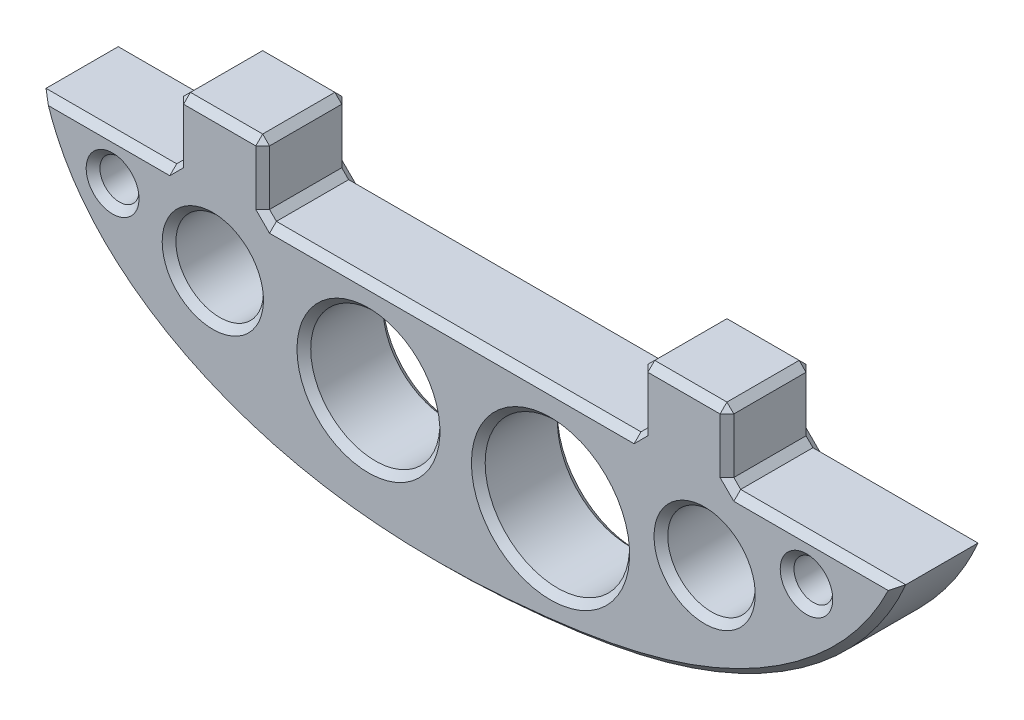
from build123d import *

# Parameters (mm, degrees)
AUFSATZ_LINEAR_AUSTRAGEN1_DEPTH = 5
SKIZZE2_W                       = 5
SKIZZE2_H                       = 5
AUFSATZ_LINEAR_AUSTRAGEN2_DEPTH = 4
SKIZZE3_R                       = 2.543920863
SKIZZE3_R_2                     = 3.757489783
SKIZZE3_R_3                     = 4.2
SKIZZE3_R_4                     = 1.137730448
SKIZZE3_R_5                     = 1.128844842
SCHNITT_LINEAR_AUSTRAGEN1_DEPTH = 29.376694263
FASE1_SIZE                      = 0.4


with BuildPart() as part:
    # Skizze1 → Aufsatz-Linear austragen1 (new body)
    with BuildSketch(Plane.XY):
        with BuildLine():
            Line((-24.996538994, 0), (25.003461006, 0))
            add(Edge.make_bspline(
                [(-24.996538994, 0), (-23.465552519, -5.427530288), (-13.555397464, -12.470085354), (1.646590995, -12.822293736), (15.822536598, -10.26391571), (23.061031095, -4.555996838), (25.003461006, 0)],
                knots=[0, 0, 0, 0, 0.271573143, 0.567800465, 0.751181327, 1, 1, 1, 1], degree=3))
        make_face()
    extrude(amount=AUFSATZ_LINEAR_AUSTRAGEN1_DEPTH)

    # Skizze2 → Aufsatz-Linear austragen2 (add)
    with BuildSketch(Plane(origin=(0, 0, 0), x_dir=(1, 0, 0), z_dir=(0, 1, 0))):
        with Locations((-14.496538994, -2.5)):
            Rectangle(SKIZZE2_W, SKIZZE2_H)
        with Locations((12.503461006, -2.5)):
            Rectangle(SKIZZE2_W, SKIZZE2_H)
    extrude(amount=AUFSATZ_LINEAR_AUSTRAGEN2_DEPTH)

    # Skizze3 → Schnitt-Linear austragen1 (cut, through all)
    with BuildSketch(Plane.XY.offset(5)):
        with Locations((-14.895570814, -3.944707729)):
            Circle(SKIZZE3_R)
        with Locations((-5.844213974, -5.43378647)):
            Circle(SKIZZE3_R_2)
        with Locations((4.742874088, -6.097546966)):
            Circle(SKIZZE3_R_3)
        with Locations((13.706342424, -4.475649879)):
            Circle(SKIZZE3_R)
        with Locations((-20.724127791, -2.455391304)):
            Circle(SKIZZE3_R_4)
        with Locations((19.630255754, -2.455391304)):
            Circle(SKIZZE3_R_5)
    extrude(amount=-SCHNITT_LINEAR_AUSTRAGEN1_DEPTH, mode=Mode.SUBTRACT)

    # Fase1
    fase1_edges = [part.edges().sort_by_distance(p)[0] for p in [
        (-20.996538994, 0, 0),
        (-16.996538994, 0, 2.5),
        (-20.996538994, 0, 5),
        (-0.269521067, -12.424518261, 0),
        (-16.996538994, 2, 0),
        (20.003461006, 0, 0),
        (-14.496538994, 4, 0),
        (15.003461006, 2, 0),
        (-11.996538994, 2, 0),
        (12.503461006, 4, 0),
        (-0.996538994, 0, 0),
        (10.003461006, 2, 0),
        (0.542874088, -6.097546966, 0),
        (11.162421561, -4.475649879, 0),
        (18.501410913, -2.455391304, 0),
        (-9.601703757, -5.43378647, 0),
        (-17.439491677, -3.944707729, 0),
        (-21.861858238, -2.455391304, 0),
        (-16.996538994, 2, 5),
        (-16.996538994, 4, 2.5),
        (-0.269521067, -12.424518261, 5),
        (20.003461006, 0, 5),
        (-14.496538994, 4, 5),
        (15.003461006, 2, 5),
        (-11.996538994, 2, 5),
        (12.503461006, 4, 5),
        (-0.996538994, 0, 5),
        (10.003461006, 2, 5),
        (0.542874088, -6.097546966, 5),
        (11.162421561, -4.475649879, 5),
        (18.501410913, -2.455391304, 5),
        (-9.601703757, -5.43378647, 5),
        (-17.439491677, -3.944707729, 5),
        (-21.861858238, -2.455391304, 5),
        (15.003461006, 0, 2.5),
        (-11.996538994, 4, 2.5),
        (15.003461006, 4, 2.5),
        (-11.996538994, 0, 2.5),
        (10.003461006, 4, 2.5),
        (10.003461006, 0, 2.5),
    ]]
    chamfer(fase1_edges, length=FASE1_SIZE)


solid = part.part
